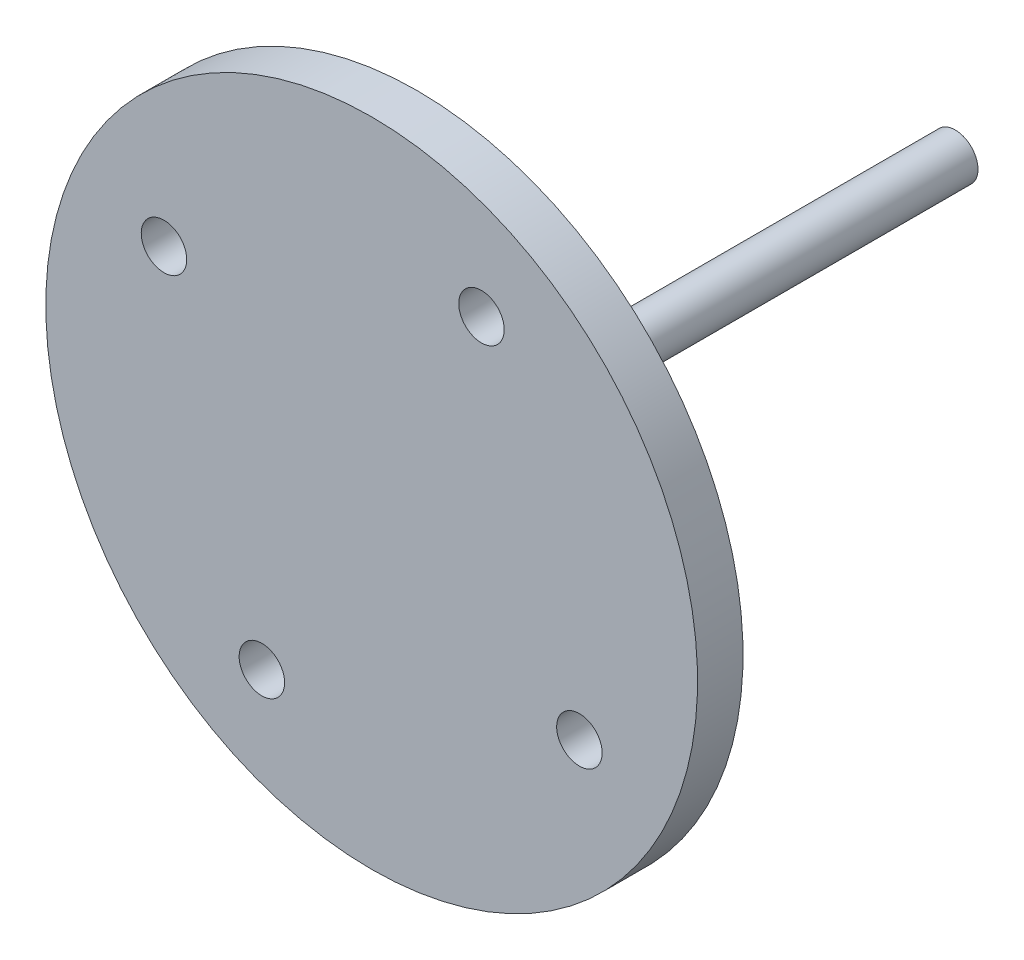
from build123d import *

# Parameters (mm, degrees)
SKETCH2_R           = 21.5
SKETCH2_R_2         = 1.5
BOSS_EXTRUDE1_DEPTH = 3
SKETCH4_R           = 1.5
BOSS_EXTRUDE3_DEPTH = 35.5


with BuildPart() as part:
    # Sketch2 → Boss-Extrude1 (new body)
    with BuildSketch(Plane(origin=(-3.810522997, 56.305896335, -32.044001089), x_dir=(-0.4673428599090645, -0.8840761569525651, 0), z_dir=(0, 0, 1))):
        with Locations(Location((0, 0, 0), (0, 0, 27.861953602))):
            Circle(SKETCH2_R)
        with Locations(Location((0, 15.5, 0), (0, 0, 27.861953602))):
            Circle(SKETCH2_R_2, mode=Mode.SUBTRACT)
        with Locations(Location((15.5, 0, 0), (0, 0, 27.861953602))):
            Circle(SKETCH2_R_2, mode=Mode.SUBTRACT)
        with Locations(Location((0, -15.5, 0), (0, 0, 27.861953602))):
            Circle(SKETCH2_R_2, mode=Mode.SUBTRACT)
        with Locations(Location((-15.5, 0, 0), (0, 0, 27.861953602))):
            Circle(SKETCH2_R_2, mode=Mode.SUBTRACT)
    extrude(amount=-BOSS_EXTRUDE1_DEPTH)

    # Sketch4 → Boss-Extrude3 (add)
    with BuildSketch(Plane(origin=(0, 0, -35.044001089), x_dir=(-1, 0, 0), z_dir=(0, 0, -1))):
        with Locations(Location((3.810522997, 56.305896335, 0), (0, 0, 270))):
            Circle(SKETCH4_R)
    extrude(amount=BOSS_EXTRUDE3_DEPTH)


solid = part.part
